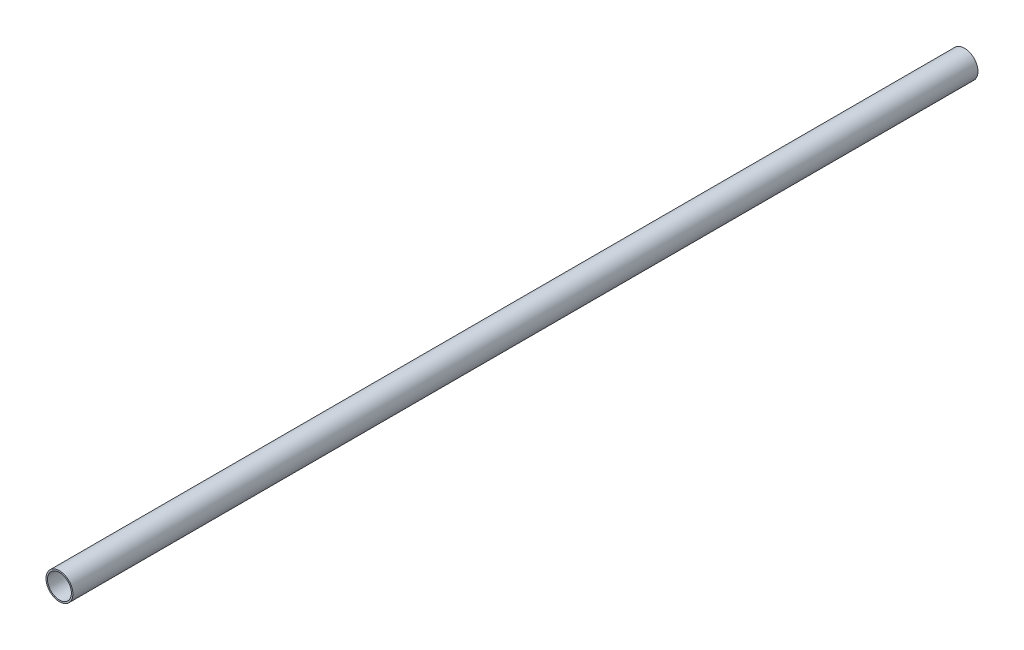
from build123d import *

# Parameters (mm, degrees)
SKETCH1_R           = 7.9375
SKETCH1_R_2         = 7.0485
BOSS_EXTRUDE1_DEPTH = 533.4


with BuildPart() as part:
    # Sketch1 → Boss-Extrude1 (new body)
    with BuildSketch(Plane.XY):
        Circle(SKETCH1_R)
        Circle(SKETCH1_R_2, mode=Mode.SUBTRACT)
    extrude(amount=BOSS_EXTRUDE1_DEPTH)


solid = part.part
